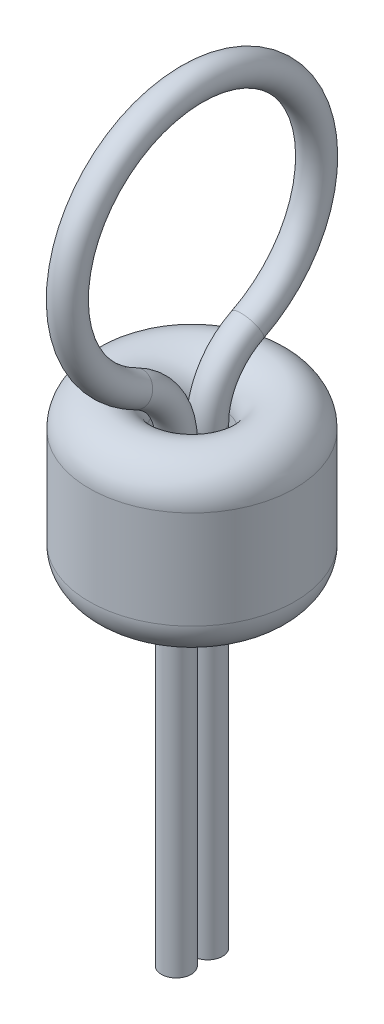
from build123d import *

# Parameters (mm, degrees)
SKETCH2_R = 0.19


with BuildPart() as part:
    # Sweep3: sweep along a path in Sketch1
    with BuildLine(Plane(origin=(0, 0, 0), x_dir=(0, 0, -1), z_dir=(1, 0, 0))) as sweep3_path:
        Line((-0.36, -2.901868218), (-0.36, 2.901868218))
        ThreePointArc((-0.36, 2.901868218), (-0.473728438, 3.301784544), (-0.780876494, 3.582011767))
        ThreePointArc((-0.780876494, 3.582011767), (0, 6.898131782), (0.780876494, 3.582011767))
        ThreePointArc((0.780876494, 3.582011767), (0.473728438, 3.301784544), (0.36, 2.901868218))
        Line((0.36, 2.901868218), (0.36, -2.901868218))
    # Sketch2 → Sweep3 (sweep)
    with BuildSketch(Plane(origin=(0, 0, 0), x_dir=(1, 0, 0), z_dir=(0, 1, 0))):
        with Locations((0, -0.2)):
            Circle(SKETCH2_R)
    sweep(path=sweep3_path.line)


with BuildPart() as body_2:
    # Sketch8 → Revolve1 (revolve)
    with BuildSketch(Plane(origin=(0, 0, 0), x_dir=(0, 0, -1), z_dir=(1, 0, 0)), mode=Mode.PRIVATE) as revolve1_sk:
        with BuildLine():
            Line((-0.41, 2.925), (-0.41, 1.675))
            ThreePointArc((-0.41, 1.675), (-0.86, 1.225), (-1.31, 1.675))
            Line((-1.31, 1.675), (-1.31, 2.925))
            ThreePointArc((-1.31, 2.925), (-0.86, 3.375), (-0.41, 2.925))
        make_face()
    revolve(revolve1_sk.sketch.rotate(Axis((0, 0, 0), (0, 1, 0)), 180), axis=Axis((0, 0, 0), (0, 1, 0)))


solid = Compound([part.part, body_2.part])
